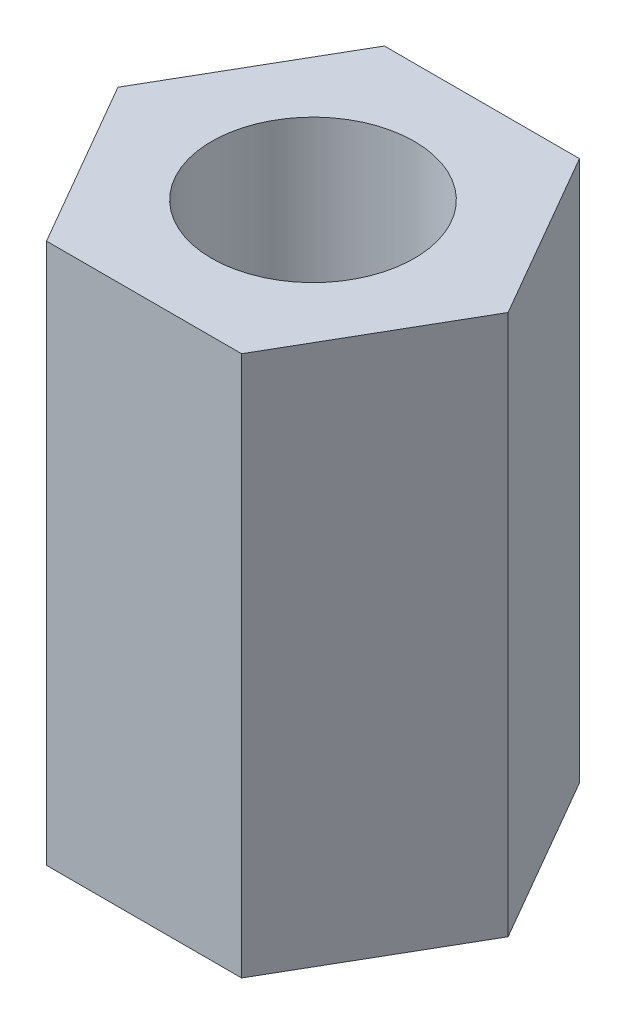
from build123d import *

# Parameters (mm, degrees)
CROQUIS1_R              = 1.5
SALIENTE_EXTRUIR1_DEPTH = 4


with BuildPart() as part:
    # Croquis1 → Saliente-Extruir1 (new, symmetric)
    with BuildSketch(Plane(origin=(0, 0, 0), x_dir=(1, 0, 0), z_dir=(0, 1, 0))):
        Polygon((1.443375673, -2.5), (2.886751346, 0), (1.443375673, 2.5), (-1.443375673, 2.5), (-2.886751346, 0), (-1.443375673, -2.5), align=None)
        with Locations(Location((0, 0, 0), (0, 0, 270))):
            Circle(CROQUIS1_R, mode=Mode.SUBTRACT)
    extrude(amount=SALIENTE_EXTRUIR1_DEPTH, both=True)


solid = part.part
